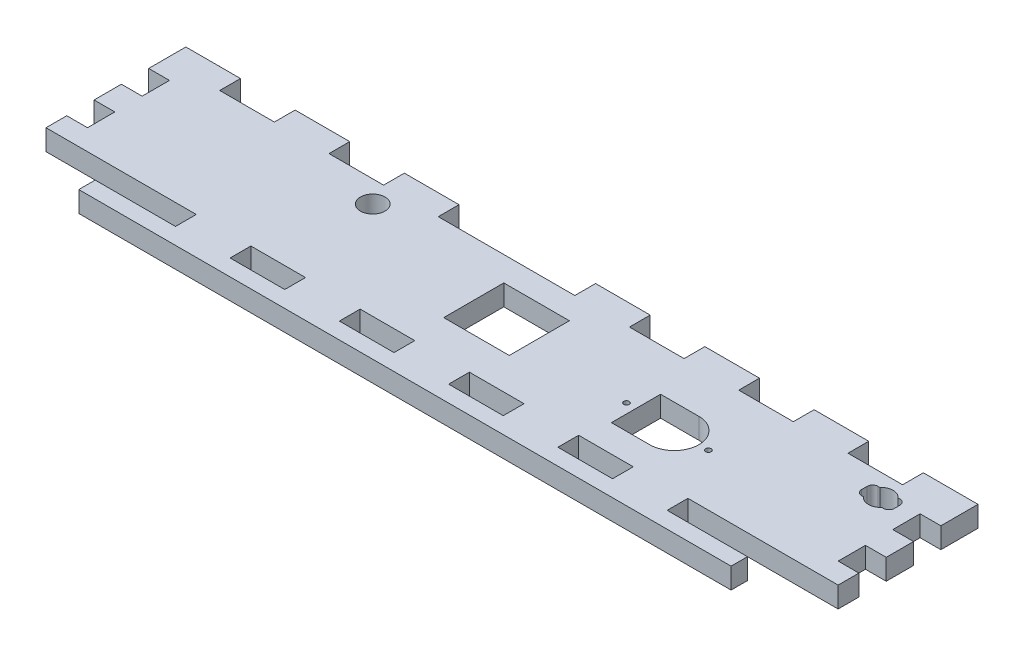
from build123d import *

# Parameters (mm, degrees)
SKETCH1_W           = 145
SKETCH1_H           = 21.8
BOSS_EXTRUDE1_DEPTH = 3.8
SKETCH2_W           = 12
SKETCH2_H           = 11
CUT_EXTRUDE1_DEPTH  = 147.678832829
SKETCH3_R           = 2.25
CUT_EXTRUDE2_DEPTH  = 147.678832829
SKETCH4_R           = 0.5
CUT_EXTRUDE3_DEPTH  = 147.678832829
SKETCH5_W           = 10
SKETCH5_H           = 3.8
BOSS_EXTRUDE2_DEPTH = 3.8
LPATTERN1_COUNT     = 4
LPATTERN1_PITCH     = 20
LPATTERN1_COL_COUNT = 4
LPATTERN1_COL_PITCH = 20
SKETCH6_W           = 145
SKETCH6_H           = 3
BOSS_EXTRUDE3_DEPTH = 3.8
SKETCH8_W           = 10
SKETCH8_H           = 3.8
CUT_EXTRUDE4_DEPTH  = 148.842483745
SKETCH9_W           = 3.8
SKETCH9_H           = 5
CUT_EXTRUDE5_DEPTH  = 148.842483745
SKETCH10_W          = 12.8
SKETCH10_H          = 3
CUT_EXTRUDE6_DEPTH  = 148.842483745
SKETCH11_W          = 10
SKETCH11_H          = 3.8
BOSS_EXTRUDE4_DEPTH = 3.8
LPATTERN2_COUNT     = 3
LPATTERN2_PITCH     = 20
SKETCH12_W          = 10
SKETCH12_H          = 3.8
BOSS_EXTRUDE5_DEPTH = 3.8
LPATTERN3_COUNT     = 4
LPATTERN3_PITCH     = 20
SKETCH13_W          = 6
SKETCH13_H          = 3
CUT_EXTRUDE7_DEPTH  = 148.842483745
FILLET1_R           = 1


with BuildPart() as part:
    # Sketch1 → Boss-Extrude1 (new body)
    with BuildSketch(Plane(origin=(0, 0, 0), x_dir=(1, 0, 0), z_dir=(0, 1, 0))):
        with Locations((72.5, -10.9)):
            Rectangle(SKETCH1_W, SKETCH1_H)
    extrude(amount=BOSS_EXTRUDE1_DEPTH)

    # Sketch2 → Cut-Extrude1 (cut, through all)
    with BuildSketch(Plane(origin=(0, 3.8, 0), x_dir=(1, 0, 0), z_dir=(0, 1, 0))):
        with Locations((72.5, -10)):
            Rectangle(SKETCH2_W, SKETCH2_H)
    extrude(amount=-CUT_EXTRUDE1_DEPTH, mode=Mode.SUBTRACT)

    # Sketch3 → Cut-Extrude2 (cut, through all)
    with BuildSketch(Plane(origin=(0, 3.8, 0), x_dir=(1, 0, 0), z_dir=(0, 1, 0))):
        with Locations(Location((42, -4, 0), (0, 0, 270))):
            Circle(SKETCH3_R)
        with Locations(Location((135, -4, 0), (0, 0, 270))):
            Circle(SKETCH3_R)
    extrude(amount=-CUT_EXTRUDE2_DEPTH, mode=Mode.SUBTRACT)

    # Sketch4 → Cut-Extrude3 (cut, through all)
    with BuildSketch(Plane(origin=(0, 3.8, 0), x_dir=(1, 0, 0), z_dir=(0, 1, 0))):
        with BuildLine():
            Line((98.5, -7.8), (98.5, -16.8))
            Line((98.5, -16.8), (105.5, -16.8))
            ThreePointArc((105.5, -16.8), (110, -12.300000006), (105.500000011, -7.8))
            Line((105.500000011, -7.8), (98.5, -7.8))
        make_face()
        with Locations(Location((96.75, -12.3, 0), (0, 0, 270))):
            Circle(SKETCH4_R)
        with Locations(Location((111.75, -12.3, 0), (0, 0, 270))):
            Circle(SKETCH4_R)
    extrude(amount=-CUT_EXTRUDE3_DEPTH, mode=Mode.SUBTRACT)

    # Sketch5 → Boss-Extrude2 (add, through all)
    with BuildSketch(Plane(origin=(0, 3.8, 0), x_dir=(1, 0, 0), z_dir=(0, 1, 0))):
        with Locations((72.5, -23.7)):
            Rectangle(SKETCH5_W, SKETCH5_H)
    boss_extrude2 = extrude(amount=-BOSS_EXTRUDE2_DEPTH)

    # LPattern1: Boss-Extrude2 ×4
    with Locations(*[(-i * LPATTERN1_PITCH, 0, 0) for i in range(1, LPATTERN1_COUNT)]):
        add(boss_extrude2)

    # LPattern1 col: Boss-Extrude2 ×4
    with Locations(*[(i * LPATTERN1_COL_PITCH, 0, 0) for i in range(1, LPATTERN1_COL_COUNT)]):
        add(boss_extrude2)

    # Sketch6 → Boss-Extrude3 (add, through all)
    with BuildSketch(Plane(origin=(0, 3.8, 0), x_dir=(1, 0, 0), z_dir=(0, 1, 0))):
        with Locations((72.5, -27.1)):
            Rectangle(SKETCH6_W, SKETCH6_H)
    extrude(amount=-BOSS_EXTRUDE3_DEPTH)

    # Sketch8 → Cut-Extrude4 (cut, through all)
    with BuildSketch(Plane(origin=(0, 0, 0), x_dir=(-1, 0, 0), z_dir=(0, -1, 0))):
        with Locations((-12.5, -23.7)):
            Rectangle(SKETCH8_W, SKETCH8_H)
        with Locations((-132.5, -23.7)):
            Rectangle(SKETCH8_W, SKETCH8_H)
    extrude(amount=-CUT_EXTRUDE4_DEPTH, mode=Mode.SUBTRACT)

    # Sketch9 → Cut-Extrude5 (cut, through all)
    with BuildSketch(Plane(origin=(0, 3.8, 0), x_dir=(1, 0, 0), z_dir=(0, 1, 0))):
        with Locations((1.9, -15.5)):
            Rectangle(SKETCH9_W, SKETCH9_H)
        with Locations((1.9, -5.5)):
            Rectangle(SKETCH9_W, SKETCH9_H)
        with Locations((143.1, -15.5)):
            Rectangle(SKETCH9_W, SKETCH9_H)
        with Locations((143.1, -5.5)):
            Rectangle(SKETCH9_W, SKETCH9_H)
    extrude(amount=-CUT_EXTRUDE5_DEPTH, mode=Mode.SUBTRACT)

    # Sketch10 → Cut-Extrude6 (cut, through all)
    with BuildSketch(Plane(origin=(0, 0, 0), x_dir=(-1, 0, 0), z_dir=(0, -1, 0))):
        with Locations((-6.4, -27.1)):
            Rectangle(SKETCH10_W, SKETCH10_H)
        with Locations((-138.6, -27.1)):
            Rectangle(SKETCH10_W, SKETCH10_H)
    extrude(amount=-CUT_EXTRUDE6_DEPTH, mode=Mode.SUBTRACT)

    # Sketch11 → Boss-Extrude4 (add, through all)
    with BuildSketch(Plane(origin=(0, 0, 0), x_dir=(-1, 0, 0), z_dir=(0, -1, 0))):
        with Locations((-5, 1.9)):
            Rectangle(SKETCH11_W, SKETCH11_H)
    boss_extrude4 = extrude(amount=-BOSS_EXTRUDE4_DEPTH)

    # LPattern2: Boss-Extrude4 ×3
    with Locations(*[(i * LPATTERN2_PITCH, 0, 0) for i in range(1, LPATTERN2_COUNT)]):
        add(boss_extrude4)

    # Sketch12 → Boss-Extrude5 (add, through all)
    with BuildSketch(Plane(origin=(0, 0, 0), x_dir=(-1, 0, 0), z_dir=(0, -1, 0))):
        with Locations((-140, 1.9)):
            Rectangle(SKETCH12_W, SKETCH12_H)
    boss_extrude5 = extrude(amount=-BOSS_EXTRUDE5_DEPTH)

    # LPattern3: Boss-Extrude5 ×4
    with Locations(*[(-i * LPATTERN3_PITCH, 0, 0) for i in range(1, LPATTERN3_COUNT)]):
        add(boss_extrude5)

    # Sketch13 → Cut-Extrude7 (cut, through all)
    with BuildSketch(Plane(origin=(0, 3.8, 0), x_dir=(1, 0, 0), z_dir=(0, 1, 0))):
        with Locations((135, -4)):
            Rectangle(SKETCH13_W, SKETCH13_H)
    extrude(amount=-CUT_EXTRUDE7_DEPTH, mode=Mode.SUBTRACT)

    # Fillet1
    fillet1_edges = [part.edges().sort_by_distance(p)[0] for p in [
        (138, 1.9, 5.5),
        (132, 1.9, 2.5),
        (138, 1.9, 2.5),
        (132, 1.9, 5.5),
    ]]
    fillet(fillet1_edges, radius=FILLET1_R)


solid = part.part
